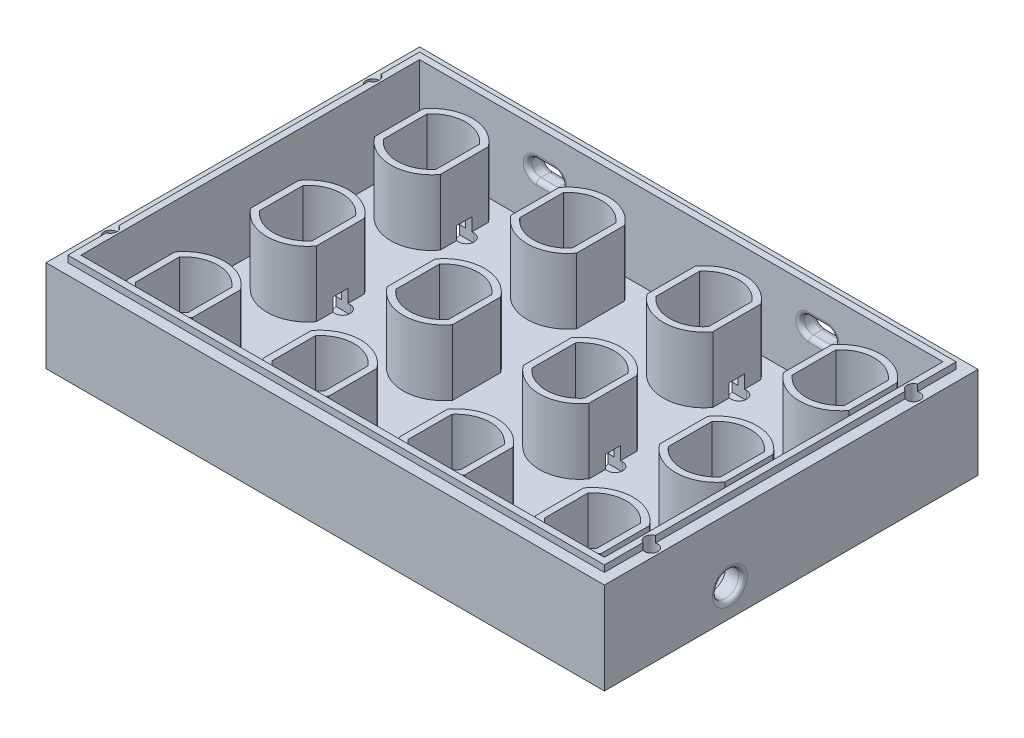
from build123d import *

# Parameters (mm, degrees)
BOSS_EXTRUDE1_DEPTH    = 15
BOSS_EXTRUDE1_2_DEPTH  = 15
BOSS_EXTRUDE1_3_DEPTH  = 15
BOSS_EXTRUDE1_4_DEPTH  = 15
BOSS_EXTRUDE1_5_DEPTH  = 15
BOSS_EXTRUDE1_6_DEPTH  = 15
BOSS_EXTRUDE1_7_DEPTH  = 15
BOSS_EXTRUDE1_8_DEPTH  = 15
BOSS_EXTRUDE1_9_DEPTH  = 15
BOSS_EXTRUDE1_10_DEPTH = 15
BOSS_EXTRUDE1_11_DEPTH = 15
BOSS_EXTRUDE1_12_DEPTH = 15
SKETCH5_W              = 127.76
SKETCH5_H              = 85.48
SKETCH5_W_2            = 119.76
SKETCH5_H_2            = 77.48
BOSS_EXTRUDE2_DEPTH    = 18
SKETCH6_W              = 127.76
SKETCH6_H              = 85.48
SKETCH6_R              = 5
BOSS_EXTRUDE3_DEPTH    = 3
SKETCH10_W             = 122.76
SKETCH10_H             = 80.48
SKETCH10_W_2           = 119.76
SKETCH10_H_2           = 77.48
BOSS_EXTRUDE4_DEPTH    = 1.5
SKETCH11_R             = 1.5
CUT_EXTRUDE1_DEPTH     = 4.5
CUT_EXTRUDE3_START     = 3
CUT_EXTRUDE3_DEPTH     = 5
CUT_EXTRUDE4_DEPTH     = 5
FILLET1_R              = 1
SKETCH15_R             = 3
CUT_EXTRUDE5_DEPTH     = 5
FILLET2_R              = 1


with BuildPart() as part:
    # Sketch4 → Boss-Extrude1 (new body)
    with BuildSketch(Plane(origin=(0, 0, 0), x_dir=(1, 0, 0), z_dir=(0, 1, 0))):
        with BuildLine():
            Line((24.622, -37.240909166), (24.622, -48.239090834))
            ThreePointArc((24.622, -48.239090834), (17.122, -52.04), (9.622, -48.239090834))
            Line((9.622, -48.239090834), (9.622, -37.240909166))
            ThreePointArc((9.622, -37.240909166), (17.122, -33.44), (24.622, -37.240909166))
        make_face()
        with BuildLine():
            ThreePointArc((23.122, -37.756025682), (17.122, -34.94), (11.122, -37.756025682))
            Line((11.122, -37.756025682), (11.122, -47.723974318))
            ThreePointArc((11.122, -47.723974318), (17.122, -50.54), (23.122, -47.723974318))
            Line((23.122, -47.723974318), (23.122, -37.756025682))
        make_face(mode=Mode.SUBTRACT)
    extrude(amount=BOSS_EXTRUDE1_DEPTH)



with BuildPart() as body_2:
    # Sketch4 → Boss-Extrude1 2 (new body)
    with BuildSketch(Plane(origin=(0, 0, 0), x_dir=(1, 0, 0), z_dir=(0, 1, 0))):
        with BuildLine():
            Line((24.622, -8.895909166), (24.622, -19.894090834))
            ThreePointArc((24.622, -19.894090834), (17.122, -23.695), (9.622, -19.894090834))
            Line((9.622, -19.894090834), (9.622, -8.895909166))
            ThreePointArc((9.622, -8.895909166), (17.122, -5.095), (24.622, -8.895909166))
        make_face()
        with BuildLine():
            ThreePointArc((23.122, -9.411025682), (17.122, -6.595), (11.122, -9.411025682))
            Line((11.122, -9.411025682), (11.122, -19.378974318))
            ThreePointArc((11.122, -19.378974318), (17.122, -22.195), (23.122, -19.378974318))
            Line((23.122, -19.378974318), (23.122, -9.411025682))
        make_face(mode=Mode.SUBTRACT)
    extrude(amount=BOSS_EXTRUDE1_2_DEPTH)


with BuildPart() as body_3:
    # Sketch4 → Boss-Extrude1 3 (new body)
    with BuildSketch(Plane(origin=(0, 0, 0), x_dir=(1, 0, 0), z_dir=(0, 1, 0))):
        with BuildLine():
            Line((55.794, -8.895909166), (55.794, -19.894090834))
            ThreePointArc((55.794, -19.894090834), (48.294, -23.695), (40.794, -19.894090834))
            Line((40.794, -19.894090834), (40.794, -8.895909166))
            ThreePointArc((40.794, -8.895909166), (48.294, -5.095), (55.794, -8.895909166))
        make_face()
        with BuildLine():
            ThreePointArc((54.294, -9.411025682), (48.294, -6.595), (42.294, -9.411025682))
            Line((42.294, -9.411025682), (42.294, -19.378974318))
            ThreePointArc((42.294, -19.378974318), (48.294, -22.195), (54.294, -19.378974318))
            Line((54.294, -19.378974318), (54.294, -9.411025682))
        make_face(mode=Mode.SUBTRACT)
    extrude(amount=BOSS_EXTRUDE1_3_DEPTH)


with BuildPart() as body_4:
    # Sketch4 → Boss-Extrude1 4 (new body)
    with BuildSketch(Plane(origin=(0, 0, 0), x_dir=(1, 0, 0), z_dir=(0, 1, 0))):
        with BuildLine():
            Line((86.966, -8.895909166), (86.966, -19.894090834))
            ThreePointArc((86.966, -19.894090834), (79.466, -23.695), (71.966, -19.894090834))
            Line((71.966, -19.894090834), (71.966, -8.895909166))
            ThreePointArc((71.966, -8.895909166), (79.466, -5.095), (86.966, -8.895909166))
        make_face()
        with BuildLine():
            ThreePointArc((85.466, -9.411025682), (79.466, -6.595), (73.466, -9.411025682))
            Line((73.466, -9.411025682), (73.466, -19.378974318))
            ThreePointArc((73.466, -19.378974318), (79.466, -22.195), (85.466, -19.378974318))
            Line((85.466, -19.378974318), (85.466, -9.411025682))
        make_face(mode=Mode.SUBTRACT)
    extrude(amount=BOSS_EXTRUDE1_4_DEPTH)


with BuildPart() as body_5:
    # Sketch4 → Boss-Extrude1 5 (new body)
    with BuildSketch(Plane(origin=(0, 0, 0), x_dir=(1, 0, 0), z_dir=(0, 1, 0))):
        with BuildLine():
            Line((118.138, -8.895909166), (118.138, -19.894090834))
            ThreePointArc((118.138, -19.894090834), (110.638, -23.695), (103.138, -19.894090834))
            Line((103.138, -19.894090834), (103.138, -8.895909166))
            ThreePointArc((103.138, -8.895909166), (110.638, -5.095), (118.138, -8.895909166))
        make_face()
        with BuildLine():
            ThreePointArc((116.638, -9.411025682), (110.638, -6.595), (104.638, -9.411025682))
            Line((104.638, -9.411025682), (104.638, -19.378974318))
            ThreePointArc((104.638, -19.378974318), (110.638, -22.195), (116.638, -19.378974318))
            Line((116.638, -19.378974318), (116.638, -9.411025682))
        make_face(mode=Mode.SUBTRACT)
    extrude(amount=BOSS_EXTRUDE1_5_DEPTH)


with BuildPart() as body_6:
    # Sketch4 → Boss-Extrude1 6 (new body)
    with BuildSketch(Plane(origin=(0, 0, 0), x_dir=(1, 0, 0), z_dir=(0, 1, 0))):
        with BuildLine():
            Line((118.138, -37.240909166), (118.138, -48.239090834))
            ThreePointArc((118.138, -48.239090834), (110.638, -52.04), (103.138, -48.239090834))
            Line((103.138, -48.239090834), (103.138, -37.240909166))
            ThreePointArc((103.138, -37.240909166), (110.638, -33.44), (118.138, -37.240909166))
        make_face()
        with BuildLine():
            ThreePointArc((116.638, -37.756025682), (110.638, -34.94), (104.638, -37.756025682))
            Line((104.638, -37.756025682), (104.638, -47.723974318))
            ThreePointArc((104.638, -47.723974318), (110.638, -50.54), (116.638, -47.723974318))
            Line((116.638, -47.723974318), (116.638, -37.756025682))
        make_face(mode=Mode.SUBTRACT)
    extrude(amount=BOSS_EXTRUDE1_6_DEPTH)


with BuildPart() as body_7:
    # Sketch4 → Boss-Extrude1 7 (new body)
    with BuildSketch(Plane(origin=(0, 0, 0), x_dir=(1, 0, 0), z_dir=(0, 1, 0))):
        with BuildLine():
            Line((86.966, -37.240909166), (86.966, -48.239090834))
            ThreePointArc((86.966, -48.239090834), (79.466, -52.04), (71.966, -48.239090834))
            Line((71.966, -48.239090834), (71.966, -37.240909166))
            ThreePointArc((71.966, -37.240909166), (79.466, -33.44), (86.966, -37.240909166))
        make_face()
        with BuildLine():
            ThreePointArc((85.466, -37.756025682), (79.466, -34.94), (73.466, -37.756025682))
            Line((73.466, -37.756025682), (73.466, -47.723974318))
            ThreePointArc((73.466, -47.723974318), (79.466, -50.54), (85.466, -47.723974318))
            Line((85.466, -47.723974318), (85.466, -37.756025682))
        make_face(mode=Mode.SUBTRACT)
    extrude(amount=BOSS_EXTRUDE1_7_DEPTH)


with BuildPart() as body_8:
    # Sketch4 → Boss-Extrude1 8 (new body)
    with BuildSketch(Plane(origin=(0, 0, 0), x_dir=(1, 0, 0), z_dir=(0, 1, 0))):
        with BuildLine():
            Line((86.966, -65.585909166), (86.966, -76.584090834))
            ThreePointArc((86.966, -76.584090834), (79.466, -80.385), (71.966, -76.584090834))
            Line((71.966, -76.584090834), (71.966, -65.585909166))
            ThreePointArc((71.966, -65.585909166), (79.466, -61.785), (86.966, -65.585909166))
        make_face()
        with BuildLine():
            ThreePointArc((85.466, -66.101025682), (79.466, -63.285), (73.466, -66.101025682))
            Line((73.466, -66.101025682), (73.466, -76.068974318))
            ThreePointArc((73.466, -76.068974318), (79.466, -78.885), (85.466, -76.068974318))
            Line((85.466, -76.068974318), (85.466, -66.101025682))
        make_face(mode=Mode.SUBTRACT)
    extrude(amount=BOSS_EXTRUDE1_8_DEPTH)


with BuildPart() as body_9:
    # Sketch4 → Boss-Extrude1 9 (new body)
    with BuildSketch(Plane(origin=(0, 0, 0), x_dir=(1, 0, 0), z_dir=(0, 1, 0))):
        with BuildLine():
            Line((118.138, -65.585909166), (118.138, -76.584090834))
            ThreePointArc((118.138, -76.584090834), (110.638, -80.385), (103.138, -76.584090834))
            Line((103.138, -76.584090834), (103.138, -65.585909166))
            ThreePointArc((103.138, -65.585909166), (110.638, -61.785), (118.138, -65.585909166))
        make_face()
        with BuildLine():
            ThreePointArc((116.638, -66.101025682), (110.638, -63.285), (104.638, -66.101025682))
            Line((104.638, -66.101025682), (104.638, -76.068974318))
            ThreePointArc((104.638, -76.068974318), (110.638, -78.885), (116.638, -76.068974318))
            Line((116.638, -76.068974318), (116.638, -66.101025682))
        make_face(mode=Mode.SUBTRACT)
    extrude(amount=BOSS_EXTRUDE1_9_DEPTH)


with BuildPart() as body_10:
    # Sketch4 → Boss-Extrude1 10 (new body)
    with BuildSketch(Plane(origin=(0, 0, 0), x_dir=(1, 0, 0), z_dir=(0, 1, 0))):
        with BuildLine():
            Line((55.794, -65.585909166), (55.794, -76.584090834))
            ThreePointArc((55.794, -76.584090834), (48.294, -80.385), (40.794, -76.584090834))
            Line((40.794, -76.584090834), (40.794, -65.585909166))
            ThreePointArc((40.794, -65.585909166), (48.294, -61.785), (55.794, -65.585909166))
        make_face()
        with BuildLine():
            ThreePointArc((54.294, -66.101025682), (48.294, -63.285), (42.294, -66.101025682))
            Line((42.294, -66.101025682), (42.294, -76.068974318))
            ThreePointArc((42.294, -76.068974318), (48.294, -78.885), (54.294, -76.068974318))
            Line((54.294, -76.068974318), (54.294, -66.101025682))
        make_face(mode=Mode.SUBTRACT)
    extrude(amount=BOSS_EXTRUDE1_10_DEPTH)


with BuildPart() as body_11:
    # Sketch4 → Boss-Extrude1 11 (new body)
    with BuildSketch(Plane(origin=(0, 0, 0), x_dir=(1, 0, 0), z_dir=(0, 1, 0))):
        with BuildLine():
            Line((24.622, -65.585909166), (24.622, -76.584090834))
            ThreePointArc((24.622, -76.584090834), (17.122, -80.385), (9.622, -76.584090834))
            Line((9.622, -76.584090834), (9.622, -65.585909166))
            ThreePointArc((9.622, -65.585909166), (17.122, -61.785), (24.622, -65.585909166))
        make_face()
        with BuildLine():
            ThreePointArc((23.122, -66.101025682), (17.122, -63.285), (11.122, -66.101025682))
            Line((11.122, -66.101025682), (11.122, -76.068974318))
            ThreePointArc((11.122, -76.068974318), (17.122, -78.885), (23.122, -76.068974318))
            Line((23.122, -76.068974318), (23.122, -66.101025682))
        make_face(mode=Mode.SUBTRACT)
    extrude(amount=BOSS_EXTRUDE1_11_DEPTH)


with BuildPart() as body_12:
    # Sketch4 → Boss-Extrude1 12 (new body)
    with BuildSketch(Plane(origin=(0, 0, 0), x_dir=(1, 0, 0), z_dir=(0, 1, 0))):
        with BuildLine():
            Line((55.794, -37.240909166), (55.794, -48.239090834))
            ThreePointArc((55.794, -48.239090834), (48.294, -52.04), (40.794, -48.239090834))
            Line((40.794, -48.239090834), (40.794, -37.240909166))
            ThreePointArc((40.794, -37.240909166), (48.294, -33.44), (55.794, -37.240909166))
        make_face()
        with BuildLine():
            ThreePointArc((54.294, -37.756025682), (48.294, -34.94), (42.294, -37.756025682))
            Line((42.294, -37.756025682), (42.294, -47.723974318))
            ThreePointArc((42.294, -47.723974318), (48.294, -50.54), (54.294, -47.723974318))
            Line((54.294, -47.723974318), (54.294, -37.756025682))
        make_face(mode=Mode.SUBTRACT)
    extrude(amount=BOSS_EXTRUDE1_12_DEPTH)


with BuildPart() as body_13:
    # Sketch5 → Boss-Extrude2 (new body)
    with BuildSketch(Plane(origin=(0, 0, 0), x_dir=(1, 0, 0), z_dir=(0, 1, 0))):
        with Locations((63.88, -42.74)):
            Rectangle(SKETCH5_W, SKETCH5_H)
        with Locations((63.88, -42.74)):
            Rectangle(SKETCH5_W_2, SKETCH5_H_2, mode=Mode.SUBTRACT)
    extrude(amount=BOSS_EXTRUDE2_DEPTH)


with BuildPart() as part_1:
    add(part.part)

    add(body_2.part)  # Boss-Extrude3 merges body 2

    add(body_3.part)  # Boss-Extrude3 merges body 3

    add(body_4.part)  # Boss-Extrude3 merges body 4

    add(body_5.part)  # Boss-Extrude3 merges body 5

    add(body_6.part)  # Boss-Extrude3 merges body 6

    add(body_7.part)  # Boss-Extrude3 merges body 7

    add(body_8.part)  # Boss-Extrude3 merges body 8

    add(body_9.part)  # Boss-Extrude3 merges body 9

    add(body_10.part)  # Boss-Extrude3 merges body 10

    add(body_11.part)  # Boss-Extrude3 merges body 11

    add(body_12.part)  # Boss-Extrude3 merges body 12

    add(body_13.part)  # Boss-Extrude3 merges body 13
    # Sketch6 → Boss-Extrude3 (add)
    with BuildSketch(Plane.XZ):
        with Locations((63.88, 42.74)):
            Rectangle(SKETCH6_W, SKETCH6_H)
        with Locations(Location((17.122, 71.085, 0), (0, 0, 270))):
            Circle(SKETCH6_R, mode=Mode.SUBTRACT)
        with Locations(Location((48.294, 71.085, 0), (0, 0, 270))):
            Circle(SKETCH6_R, mode=Mode.SUBTRACT)
        with Locations(Location((79.466, 71.085, 0), (0, 0, 270))):
            Circle(SKETCH6_R, mode=Mode.SUBTRACT)
        with Locations(Location((110.638, 71.085, 0), (0, 0, 270))):
            Circle(SKETCH6_R, mode=Mode.SUBTRACT)
        with Locations(Location((48.294, 42.74, 0), (0, 0, 270))):
            Circle(SKETCH6_R, mode=Mode.SUBTRACT)
        with Locations(Location((79.466, 42.74, 0), (0, 0, 270))):
            Circle(SKETCH6_R, mode=Mode.SUBTRACT)
        with Locations(Location((110.638, 42.74, 0), (0, 0, 270))):
            Circle(SKETCH6_R, mode=Mode.SUBTRACT)
        with Locations(Location((48.294, 14.395, 0), (0, 0, 270))):
            Circle(SKETCH6_R, mode=Mode.SUBTRACT)
        with Locations(Location((79.466, 14.395, 0), (0, 0, 270))):
            Circle(SKETCH6_R, mode=Mode.SUBTRACT)
        with Locations(Location((110.638, 14.395, 0), (0, 0, 270))):
            Circle(SKETCH6_R, mode=Mode.SUBTRACT)
        with Locations(Location((17.122, 42.74, 0), (0, 0, 270))):
            Circle(SKETCH6_R, mode=Mode.SUBTRACT)
        with Locations(Location((17.122, 14.395, 0), (0, 0, 270))):
            Circle(SKETCH6_R, mode=Mode.SUBTRACT)
    extrude(amount=BOSS_EXTRUDE3_DEPTH)

    # Sketch10 → Boss-Extrude4 (add)
    with BuildSketch(Plane(origin=(0, 18, 0), x_dir=(1, 0, 0), z_dir=(0, 1, 0))):
        with Locations((63.88, -42.74)):
            Rectangle(SKETCH10_W, SKETCH10_H)
        with Locations((63.88, -42.74)):
            Rectangle(SKETCH10_W_2, SKETCH10_H_2, mode=Mode.SUBTRACT)
    extrude(amount=BOSS_EXTRUDE4_DEPTH)

    # Sketch11 → Cut-Extrude1 (cut)
    with BuildSketch(Plane(origin=(0, 19.5, 0), x_dir=(1, 0, 0), z_dir=(0, 1, 0))):
        with Locations(Location((2, -12.74, 0), (0, 0, 270))):
            Circle(SKETCH11_R)
        with Locations(Location((2, -72.74, 0), (0, 0, 270))):
            Circle(SKETCH11_R)
        with Locations(Location((125.76, -12.74, 0), (0, 0, 270))):
            Circle(SKETCH11_R)
        with Locations(Location((125.76, -72.74, 0), (0, 0, 270))):
            Circle(SKETCH11_R)
    extrude(amount=-CUT_EXTRUDE1_DEPTH, mode=Mode.SUBTRACT)

    # Sketch13 → Cut-Extrude3 (cut)
    with BuildSketch(Plane(origin=(0, 0, 0), x_dir=(1, 0, 0), z_dir=(0, 1, 0)).offset(CUT_EXTRUDE3_START)):
        with BuildLine():
            Line((17.122, -12.645), (25.122, -12.645))
            ThreePointArc((25.122, -12.645), (26.872, -14.395), (25.122, -16.145))
            Line((25.122, -16.145), (17.122, -16.145))
            ThreePointArc((17.122, -16.145), (15.372, -14.395), (17.122, -12.645))
        make_face()
        with BuildLine():
            Line((40.294, -12.645), (48.294, -12.645))
            ThreePointArc((48.294, -12.645), (50.044, -14.395), (48.294, -16.145))
            Line((48.294, -16.145), (40.294, -16.145))
            ThreePointArc((40.294, -16.145), (38.544, -14.395), (40.294, -12.645))
        make_face()
        with BuildLine():
            Line((40.294, -40.99), (48.294, -40.99))
            ThreePointArc((48.294, -40.99), (50.044, -42.74), (48.294, -44.49))
            Line((48.294, -44.49), (40.294, -44.49))
            ThreePointArc((40.294, -44.49), (38.544, -42.74), (40.294, -40.99))
        make_face()
        with BuildLine():
            Line((40.294, -69.335), (48.294, -69.335))
            ThreePointArc((48.294, -69.335), (50.044, -71.085), (48.294, -72.835))
            Line((48.294, -72.835), (40.294, -72.835))
            ThreePointArc((40.294, -72.835), (38.544, -71.085), (40.294, -69.335))
        make_face()
        with BuildLine():
            Line((17.122, -40.99), (25.122, -40.99))
            ThreePointArc((25.122, -40.99), (26.872, -42.74), (25.122, -44.49))
            Line((25.122, -44.49), (17.122, -44.49))
            ThreePointArc((17.122, -44.49), (15.372, -42.74), (17.122, -40.99))
        make_face()
        with BuildLine():
            Line((17.122, -69.335), (25.122, -69.335))
            ThreePointArc((25.122, -69.335), (26.872, -71.085), (25.122, -72.835))
            Line((25.122, -72.835), (17.122, -72.835))
            ThreePointArc((17.122, -72.835), (15.372, -71.085), (17.122, -69.335))
        make_face()
        with BuildLine():
            Line((79.466, -12.645), (87.466, -12.645))
            ThreePointArc((87.466, -12.645), (89.216, -14.395), (87.466, -16.145))
            Line((87.466, -16.145), (79.466, -16.145))
            ThreePointArc((79.466, -16.145), (77.716, -14.395), (79.466, -12.645))
        make_face()
        with BuildLine():
            Line((102.638, -12.645), (110.638, -12.645))
            ThreePointArc((110.638, -12.645), (112.388, -14.395), (110.638, -16.145))
            Line((110.638, -16.145), (102.638, -16.145))
            ThreePointArc((102.638, -16.145), (100.888, -14.395), (102.638, -12.645))
        make_face()
        with BuildLine():
            Line((102.638, -40.99), (110.638, -40.99))
            ThreePointArc((110.638, -40.99), (112.388, -42.74), (110.638, -44.49))
            Line((110.638, -44.49), (102.638, -44.49))
            ThreePointArc((102.638, -44.49), (100.888, -42.74), (102.638, -40.99))
        make_face()
        with BuildLine():
            Line((102.638, -69.335), (110.638, -69.335))
            ThreePointArc((110.638, -69.335), (112.388, -71.085), (110.638, -72.835))
            Line((110.638, -72.835), (102.638, -72.835))
            ThreePointArc((102.638, -72.835), (100.888, -71.085), (102.638, -69.335))
        make_face()
        with BuildLine():
            Line((79.466, -40.99), (87.466, -40.99))
            ThreePointArc((87.466, -40.99), (89.216, -42.74), (87.466, -44.49))
            Line((87.466, -44.49), (79.466, -44.49))
            ThreePointArc((79.466, -44.49), (77.716, -42.74), (79.466, -40.99))
        make_face()
        with BuildLine():
            Line((79.466, -69.335), (87.466, -69.335))
            ThreePointArc((87.466, -69.335), (89.216, -71.085), (87.466, -72.835))
            Line((87.466, -72.835), (79.466, -72.835))
            ThreePointArc((79.466, -72.835), (77.716, -71.085), (79.466, -69.335))
        make_face()
    extrude(amount=-CUT_EXTRUDE3_DEPTH, mode=Mode.SUBTRACT)

    # Sketch14 → Cut-Extrude4 (cut)
    with BuildSketch(Plane(origin=(0, 0, 0), x_dir=(-1, 0, 0), z_dir=(0, 0, -1))):
        with BuildLine():
            Line((-97.053, 13), (-93.053, 13))
            ThreePointArc((-93.053, 13), (-91.053, 11), (-93.053, 9))
            Line((-93.053, 9), (-97.053, 9))
            ThreePointArc((-97.053, 9), (-99.053, 11), (-97.053, 13))
        make_face()
        with BuildLine():
            Line((-34.709, 13), (-30.709, 13))
            ThreePointArc((-30.709, 13), (-28.709, 11), (-30.709, 9))
            Line((-30.709, 9), (-34.709, 9))
            ThreePointArc((-34.709, 9), (-36.709, 11), (-34.709, 13))
        make_face()
    extrude(amount=-CUT_EXTRUDE4_DEPTH, mode=Mode.SUBTRACT)

    # Fillet1
    fillet1_edges = [part_1.edges().sort_by_distance(p)[0] for p in [
        (32.709, 9, 4),
        (28.709, 11, 4),
        (32.709, 13, 4),
        (36.709, 11, 4),
        (95.053, 9, 4),
        (91.053, 11, 4),
        (95.053, 13, 4),
        (99.053, 11, 4),
        (99.053, 11, 0),
        (95.053, 9, 0),
        (91.053, 11, 0),
        (95.053, 13, 0),
        (36.709, 11, 0),
        (32.709, 9, 0),
        (28.709, 11, 0),
        (32.709, 13, 0),
    ]]
    fillet(fillet1_edges, radius=FILLET1_R)

    # Sketch15 → Cut-Extrude5 (cut)
    with BuildSketch(Plane(origin=(127.76, 0, 0), x_dir=(0, 0, -1), z_dir=(1, 0, 0))):
        with Locations((-56.785, 3.5)):
            Circle(SKETCH15_R)
    extrude(amount=-CUT_EXTRUDE5_DEPTH, mode=Mode.SUBTRACT)

    # Fillet2
    fillet2_edges = [part_1.edges().sort_by_distance(p)[0] for p in [
        (127.76, 3.5, 59.785),
    ]]
    fillet(fillet2_edges, radius=FILLET2_R)


solid = part_1.part
